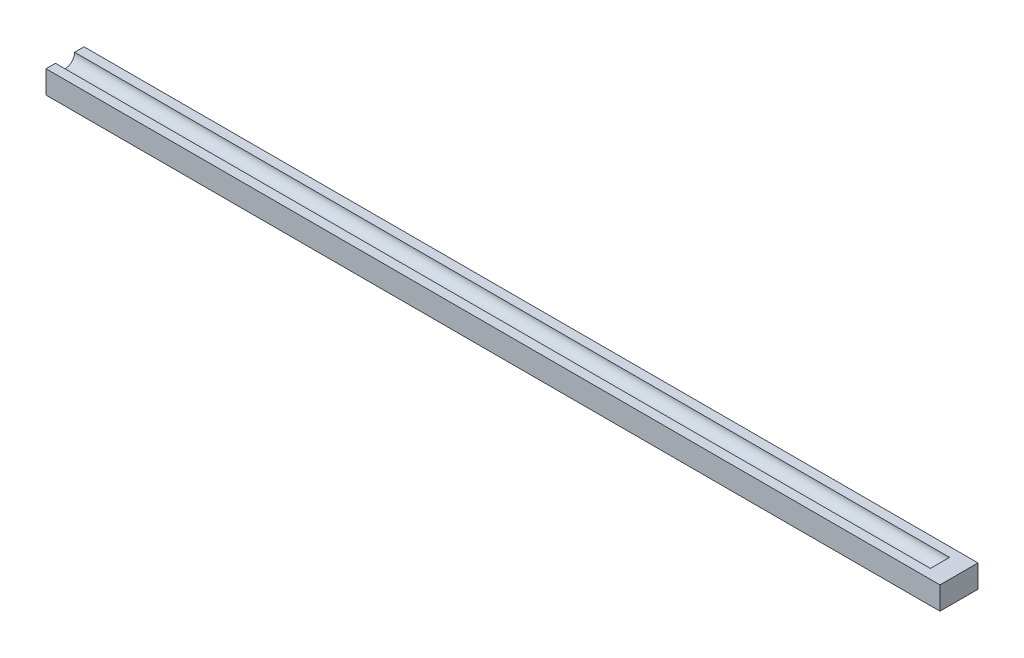
from build123d import *

# Parameters (mm, degrees)
SKETCH_1_W          = 235
SKETCH_1_H          = 10
EXTRUDE_1_DEPTH     = 6
SKETCH_4_R          = 2.515
CUT_EXTRUDE_1_DEPTH = 230


with BuildPart() as part:
    # 草图1 → 凸台-拉伸1 (new body)
    with BuildSketch(Plane(origin=(0, 0, 0), x_dir=(1, 0, 0), z_dir=(0, 1, 0))):
        with Locations((117.5, 0)):
            Rectangle(SKETCH_1_W, SKETCH_1_H)
    extrude(amount=EXTRUDE_1_DEPTH)

    # 草图4 → 切除-拉伸1 (cut)
    with BuildSketch(Plane.ZY):
        with Locations((0, 6)):
            Circle(SKETCH_4_R)
    extrude(amount=-CUT_EXTRUDE_1_DEPTH, mode=Mode.SUBTRACT)


solid = part.part
